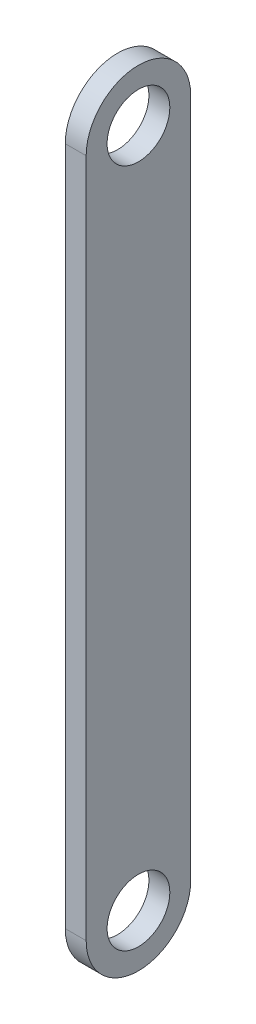
from build123d import *

# Parameters (mm, degrees)
SKETCH_1_R      = 3
EXTRUDE_1_DEPTH = 2


with BuildPart() as part:
    # 草图1 → 凸台-拉伸1 (new body)
    with BuildSketch(Plane(origin=(0, 0, 0), x_dir=(0, 0, -1), z_dir=(1, 0, 0))):
        with BuildLine():
            Line((-5, -32.5), (-5, 32.5))
            ThreePointArc((-5, 32.5), (0, 37.5), (5, 32.5))
            Line((5, 32.5), (5, -32.5))
            ThreePointArc((5, -32.5), (0, -37.5), (-5, -32.5))
        make_face()
        with Locations((0, 32.5)):
            Circle(SKETCH_1_R, mode=Mode.SUBTRACT)
        with Locations((0, -32.5)):
            Circle(SKETCH_1_R, mode=Mode.SUBTRACT)
    extrude(amount=EXTRUDE_1_DEPTH)


solid = part.part
